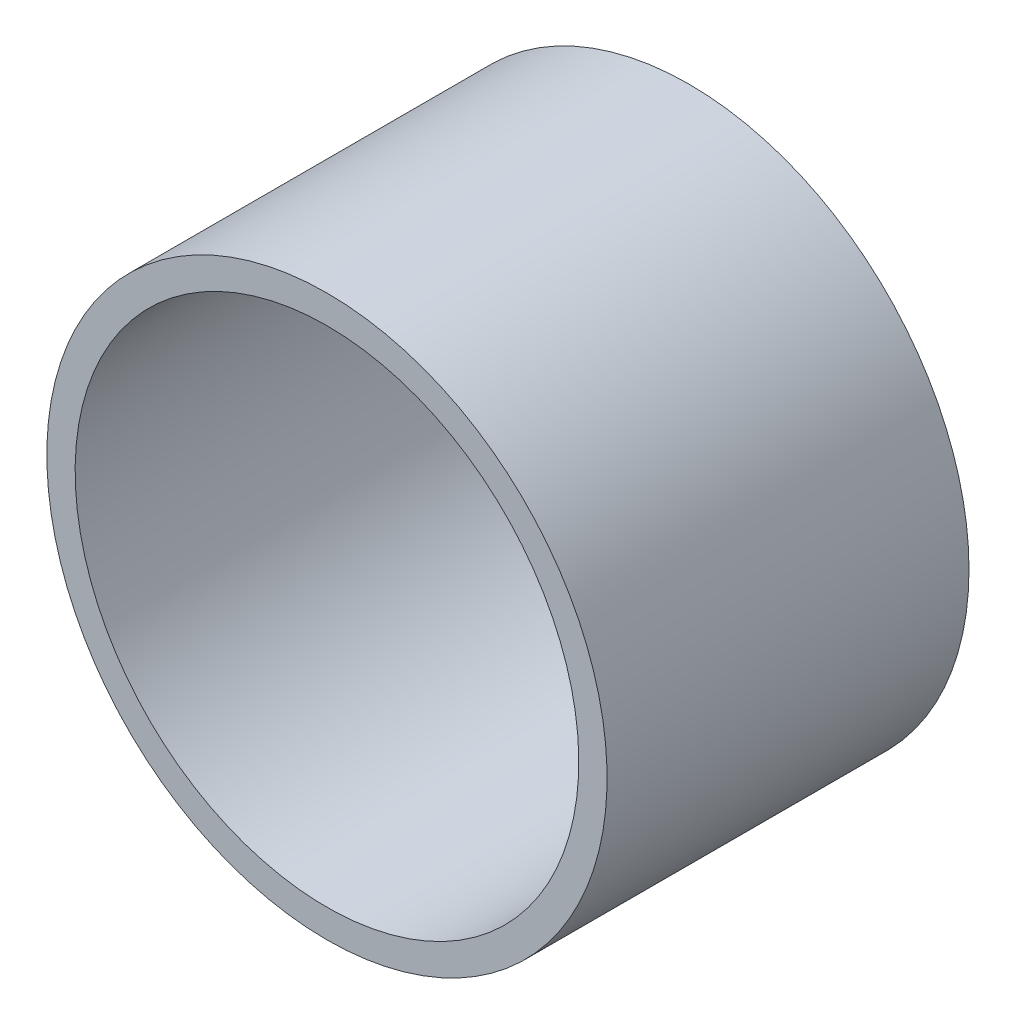
from build123d import *

# Parameters (mm, degrees)
SKETCH1_R           = 25.146
SKETCH1_R_2         = 22.606
BOSS_EXTRUDE1_DEPTH = 32.486875


with BuildPart() as part:
    # Sketch1 → Boss-Extrude1 (new body)
    with BuildSketch(Plane.XY):
        with Locations(Location((0, 0, 0), (0, 0, 90))):
            Circle(SKETCH1_R)
        with Locations(Location((0, 0, 0), (0, 0, 90))):
            Circle(SKETCH1_R_2, mode=Mode.SUBTRACT)
    extrude(amount=BOSS_EXTRUDE1_DEPTH)


solid = part.part
